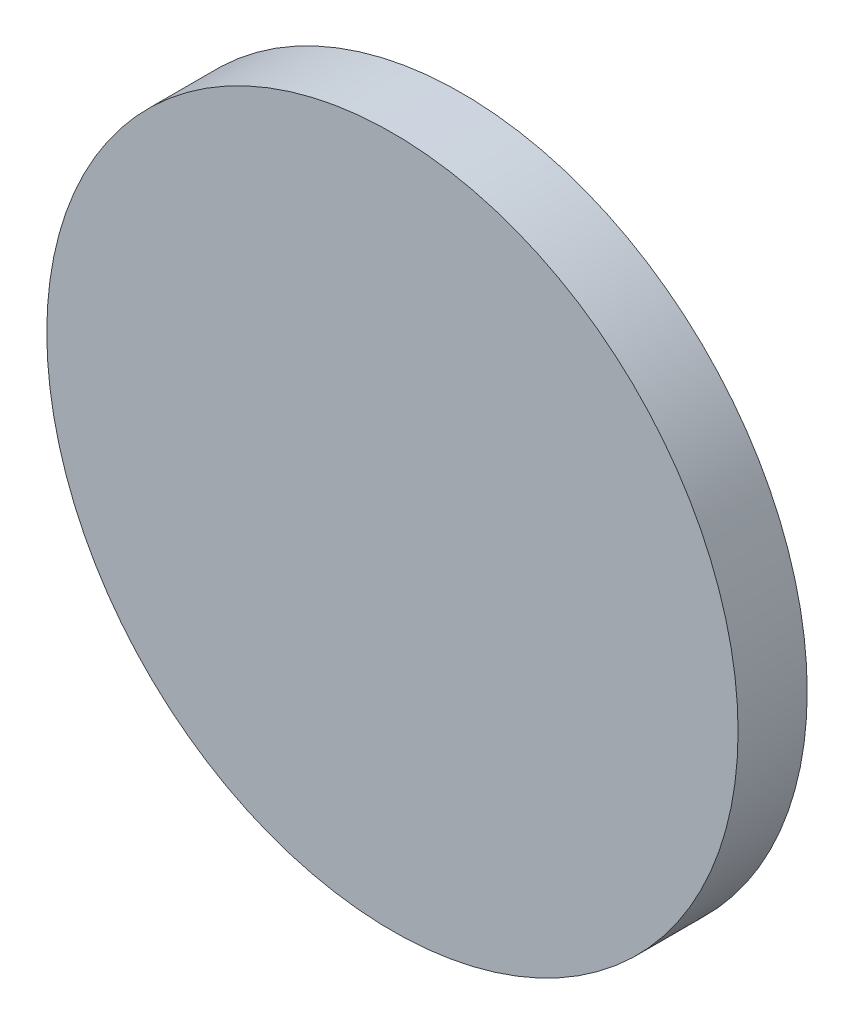
from build123d import *

# Parameters (mm, degrees)
SKETCH1_R           = 7.5
BOSS_EXTRUDE1_DEPTH = 1.5


with BuildPart() as part:
    # Sketch1 → Boss-Extrude1 (new body)
    with BuildSketch(Plane.XY):
        with Locations((-62.390580796, -116)):
            Circle(SKETCH1_R)
    extrude(amount=-BOSS_EXTRUDE1_DEPTH)


solid = part.part
